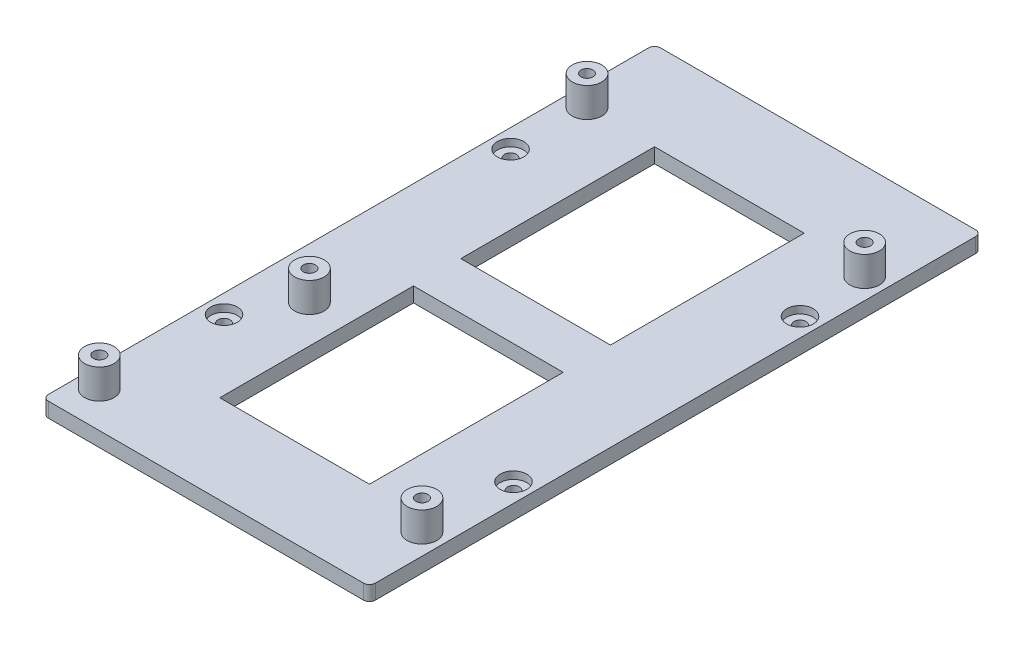
from build123d import *

# Parameters (mm, degrees)
BOSS_EXTRU_1_DEPTH      = 1.25
BOSS_EXTRU_1_DEPTH_BACK = 1.25
ESQUISSE1_W             = 55.34
ESQUISSE1_H             = 103.6
ESQUISSE1_R             = 1.0065
ESQUISSE2_R             = 2.25
ENL_V_MAT_EXTRU_1_DEPTH = 1.25
ESQUISSE4_R             = 2.5
BOSS_EXTRU_3_DEPTH      = 5
ESQUISSE7_R             = 1.025
ESQUISSE7_R_2           = 1.0125
ENL_V_MAT_EXTRU_2_DEPTH = 5
ESQUISSE8_W             = 25.34
ESQUISSE8_H             = 73.6
ENL_V_MAT_EXTRU_3_DEPTH = 59.939535967
ESQUISSE16_W            = 25.34
ESQUISSE16_H            = 8
BOSS_EXTRU_6_DEPTH      = 2.5
CONG_8_R                = 1


with BuildPart() as part:
    # Esquisse1 → Boss.-Extru.1 (new, two sides: drawn at the far end of the back side and taken through both)
    with BuildSketch(Plane(origin=(0, 0, 0), x_dir=(1, 0, 0), z_dir=(0, 1, 0)).offset(-BOSS_EXTRU_1_DEPTH_BACK)):
        Rectangle(ESQUISSE1_W, ESQUISSE1_H)
        with Locations((24.5, -24.25)):
            Circle(ESQUISSE1_R, mode=Mode.SUBTRACT)
        with Locations((-24.5, -24.25)):
            Circle(ESQUISSE1_R, mode=Mode.SUBTRACT)
        with Locations((24.5, 24.25)):
            Circle(ESQUISSE1_R, mode=Mode.SUBTRACT)
        with Locations((-24.5, 24.25)):
            Circle(ESQUISSE1_R, mode=Mode.SUBTRACT)
    extrude(amount=BOSS_EXTRU_1_DEPTH + BOSS_EXTRU_1_DEPTH_BACK)

    # Esquisse2 → Enlèv. mat.-Extru.1 (cut)
    with BuildSketch(Plane(origin=(0, 1.25, 0), x_dir=(1, 0, 0), z_dir=(0, 1, 0))):
        with Locations((-24.5, 24.25)):
            Circle(ESQUISSE2_R)
        with Locations((24.5, 24.25)):
            Circle(ESQUISSE2_R)
        with Locations((24.5, -24.25)):
            Circle(ESQUISSE2_R)
        with Locations((-24.5, -24.25)):
            Circle(ESQUISSE2_R)
    extrude(amount=-ENL_V_MAT_EXTRU_1_DEPTH, mode=Mode.SUBTRACT)

    # Esquisse4 → Boss.-Extru.3 (add)
    with BuildSketch(Plane(origin=(0, 1.25, 0), x_dir=(1, 0, 0), z_dir=(0, 1, 0))):
        with Locations((-19.05, -15.24)):
            Circle(ESQUISSE4_R)
        with Locations((-24.13, -45.72)):
            Circle(ESQUISSE4_R)
        with Locations((24.13, -39.37)):
            Circle(ESQUISSE4_R)
        with Locations((24.13, 35.56)):
            Circle(ESQUISSE4_R)
        with Locations((-24.13, 36.83)):
            Circle(ESQUISSE4_R)
    extrude(amount=BOSS_EXTRU_3_DEPTH)

    # Esquisse7 → Enlèv. mat.-Extru.2 (cut)
    with BuildSketch(Plane(origin=(0, 6.25, 0), x_dir=(1, 0, 0), z_dir=(0, 1, 0))):
        with Locations((-24.13, -45.72)):
            Circle(ESQUISSE7_R)
        with Locations((-24.13, 36.83)):
            Circle(ESQUISSE7_R_2)
        with Locations((24.13, -39.37)):
            Circle(ESQUISSE7_R)
        with Locations((24.13, 35.56)):
            Circle(ESQUISSE7_R)
        with Locations((-19.05, -15.24)):
            Circle(ESQUISSE7_R)
    extrude(amount=-ENL_V_MAT_EXTRU_2_DEPTH, mode=Mode.SUBTRACT)

    # Esquisse8 → Enlèv. mat.-Extru.3 (cut, through all)
    with BuildSketch(Plane(origin=(0, 1.25, 0), x_dir=(1, 0, 0), z_dir=(0, 1, 0))):
        Rectangle(ESQUISSE8_W, ESQUISSE8_H)
    extrude(amount=-ENL_V_MAT_EXTRU_3_DEPTH, mode=Mode.SUBTRACT)

    # Esquisse16 → Boss.-Extru.6 (add)
    with BuildSketch(Plane(origin=(0, 1.25, 0), x_dir=(1, 0, 0), z_dir=(0, 1, 0))):
        Rectangle(ESQUISSE16_W, ESQUISSE16_H)
    extrude(amount=-BOSS_EXTRU_6_DEPTH)

    # Congé8
    cong_8_edges = [part.edges().sort_by_distance(p)[0] for p in [
        (27.67, 0, 51.8),
        (-27.67, 0, 51.8),
        (-27.67, 0, -51.8),
        (27.67, 0, -51.8),
    ]]
    fillet(cong_8_edges, radius=CONG_8_R)


solid = part.part
